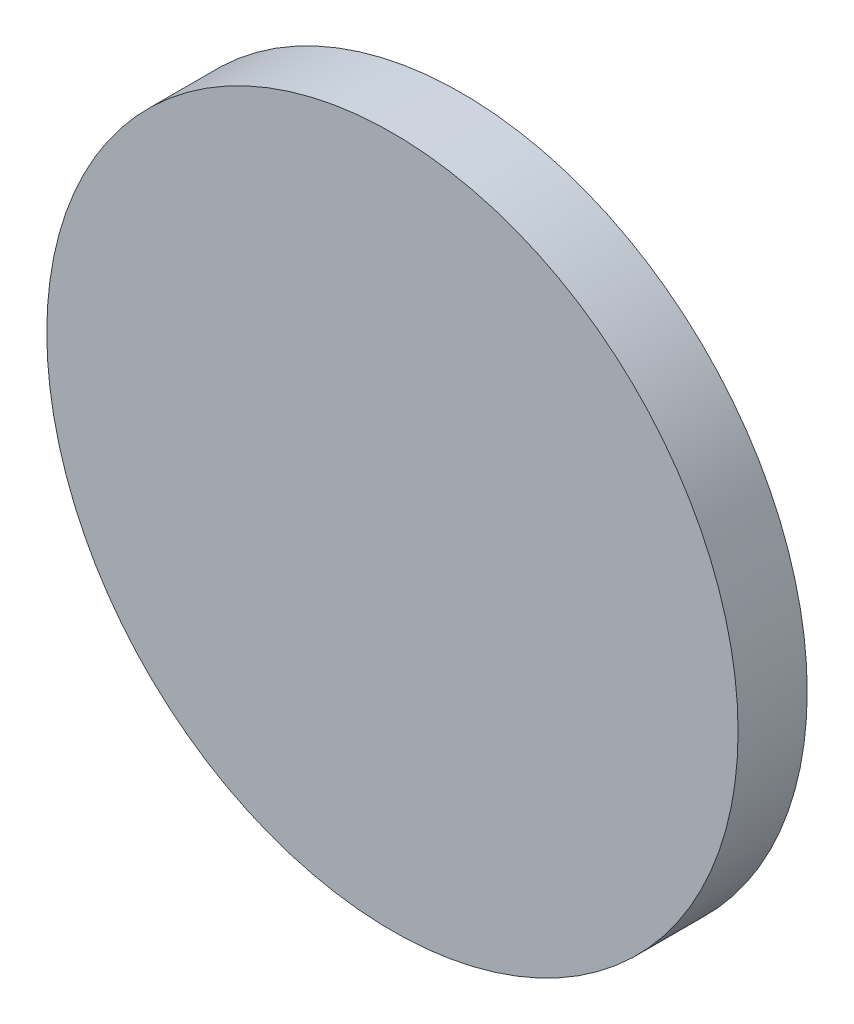
from build123d import *

# Parameters (mm, degrees)
SKETCH1_R           = 10
BOSS_EXTRUDE1_DEPTH = 2


with BuildPart() as part:
    # Sketch1 → Boss-Extrude1 (new body)
    with BuildSketch(Plane.XY):
        Circle(SKETCH1_R)
    extrude(amount=BOSS_EXTRUDE1_DEPTH)


solid = part.part
